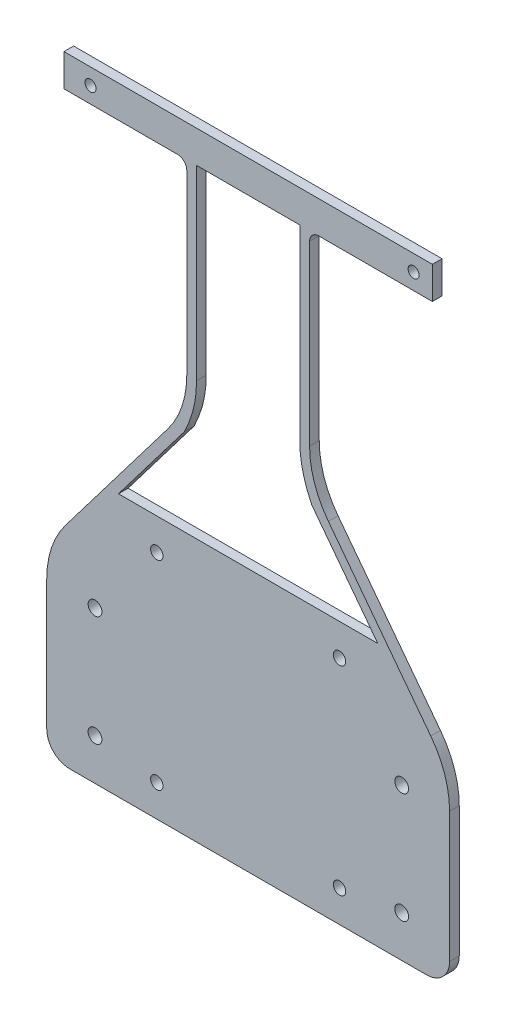
from build123d import *

# Parameters (mm, degrees)
SKETCH2_R           = 1.35
SKETCH2_R_2         = 1.5
SKETCH2_R_3         = 1.2
BOSS_EXTRUDE1_DEPTH = 2.1


with BuildPart() as part:
    # Sketch2 → Boss-Extrude1 (new body)
    with BuildSketch(Plane.XY):
        with BuildLine():
            Line((26.360509399, -75.742028439), (106.365509399, -75.742028439))
            Line((106.365509399, -75.742028439), (106.365509399, -82.742028439))
            Line((106.365509399, -82.742028439), (96.904474191, -82.742028439))
            Line((96.904474191, -82.742028439), (81.697018799, -82.742028439))
            ThreePointArc((81.697018799, -82.742028439), (80.282805236, -83.327814877), (79.697018799, -84.742028439))
            Line((79.697018799, -84.742028439), (79.697018799, -123.261425865))
            ThreePointArc((79.697018799, -123.261425865), (80.744039239, -129.647705362), (83.77547538, -135.365328342))
            Line((83.77547538, -135.365328342), (106.022052818, -164.628605146))
            ThreePointArc((106.022052818, -164.628605146), (109.053488959, -170.346228126), (110.100509399, -176.732507623))
            Line((110.100509399, -176.732507623), (110.100509399, -204.994023391))
            ThreePointArc((110.100509399, -204.994023391), (108.636252911, -208.529347679), (105.101102272, -209.994023356))
            Line((105.101102272, -209.994023356), (54.697018799, -210))
            Line((54.697018799, -210), (25.307981201, -210))
            Line((25.307981201, -210), (27.625509399, -210))
            ThreePointArc((27.625509399, -210), (24.089975493, -208.535533906), (22.625509399, -205))
            Line((22.625509399, -205), (22.625509399, -176.738128469))
            ThreePointArc((22.625509399, -176.738128469), (23.672257836, -170.352656272), (26.702934917, -164.635582379))
            Line((26.702934917, -164.635582379), (48.951574482, -135.364417621))
            ThreePointArc((48.951574482, -135.364417621), (51.982251563, -129.647343728), (53.029, -123.261871531))
            Line((53.029, -123.261871531), (53.029, -84.742028439))
            ThreePointArc((53.029, -84.742028439), (52.443213562, -83.327814877), (51.029, -82.742028439))
            Line((51.029, -82.742028439), (37.207455392, -82.742028439))
            Line((37.207455392, -82.742028439), (26.360509399, -82.742028439))
            Line((26.360509399, -82.742028439), (26.360509399, -75.742028439))
        make_face()
        with Locations((46.525509399, -159.877)):
            Circle(SKETCH2_R, mode=Mode.SUBTRACT)
        with Locations((46.525509399, -203.1)):
            Circle(SKETCH2_R, mode=Mode.SUBTRACT)
        with Locations((86.200509399, -203.1)):
            Circle(SKETCH2_R, mode=Mode.SUBTRACT)
        with Locations((86.200509399, -159.877)):
            Circle(SKETCH2_R, mode=Mode.SUBTRACT)
        with Locations((33.106129256, -201)):
            Circle(SKETCH2_R_2, mode=Mode.SUBTRACT)
        with Locations((33.106129256, -177)):
            Circle(SKETCH2_R_2, mode=Mode.SUBTRACT)
        with Locations((99.697018799, -177)):
            Circle(SKETCH2_R_2, mode=Mode.SUBTRACT)
        with Locations((99.697018799, -201)):
            Circle(SKETCH2_R_2, mode=Mode.SUBTRACT)
        with Locations((32.132455392, -79.242028439)):
            Circle(SKETCH2_R_3, mode=Mode.SUBTRACT)
        with Locations((102.282455392, -79.242028439)):
            Circle(SKETCH2_R_3, mode=Mode.SUBTRACT)
        with BuildLine():
            Line((55.129, -82.742028439), (77.597018799, -82.742028439))
            Line((77.597018799, -82.742028439), (77.597018799, -123.261871531))
            add(Edge.make_bspline(
                [(80.187269615, -134.115336952), (77.487014109, -128.558048488), (77.597018799, -123.261871531)],
                knots=[0, 0, 0, 0.393827238, 0.393827238, 0.393827238], degree=2))
            Line((80.187269615, -134.115336952), (94.526314775, -152.977))
            Line((94.526314775, -152.977), (38.202239304, -152.977))
            Line((38.202239304, -152.977), (52.538749184, -134.115336952))
            add(Edge.make_bspline(
                [(52.538749184, -134.115336952), (55.239004689, -128.558048488), (55.129, -123.261871531)],
                knots=[0, 0, 0, 0.393827238, 0.393827238, 0.393827238], degree=2))
            Line((55.129, -123.261871531), (55.129, -82.742028439))
        make_face(mode=Mode.SUBTRACT)
    extrude(amount=BOSS_EXTRUDE1_DEPTH)


solid = part.part
